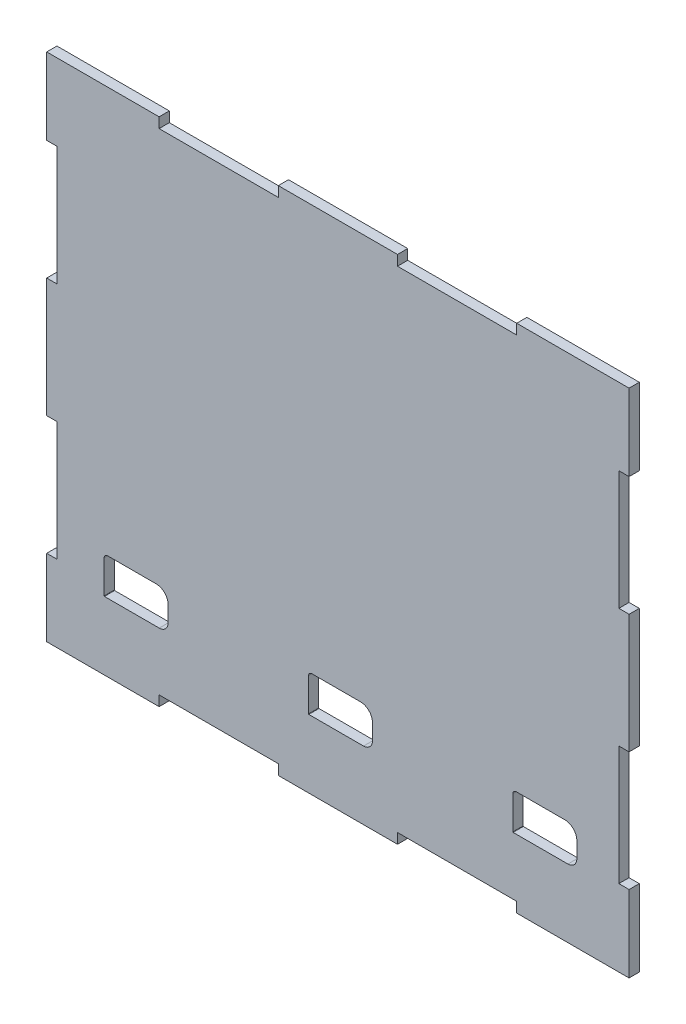
from build123d import *

# Parameters (mm, degrees)
BOSS_EXTRUDE1_DEPTH = 3
CUT_EXTRUDE1_DEPTH  = 114.772799913


with BuildPart() as part:
    # Model → Boss-Extrude1 (new body)
    with BuildSketch(Plane.XY):
        Polygon((85.5, 75), (82.5, 75), (52.5, 75), (52.5, 72), (17.5, 72), (17.5, 75), (-17.5, 75), (-17.5, 72), (-52.5, 72), (-52.5, 75), (-82.5, 75), (-85.5, 75), (-85.5, 72), (-85.5, 52.5), (-82.5, 52.5), (-82.5, 17.5), (-85.5, 17.5), (-85.5, -17.5), (-82.5, -17.5), (-82.5, -52.5), (-85.5, -52.5), (-85.5, -72), (-85.5, -75), (-82.5, -75), (-52.5, -75), (-52.5, -72), (-17.5, -72), (-17.5, -75), (17.5, -75), (17.5, -72), (52.5, -72), (52.5, -75), (82.5, -75), (85.5, -75), (85.5, -72), (85.5, -52.5), (82.5, -52.5), (82.5, -17.5), (85.5, -17.5), (85.5, 17.5), (82.5, 17.5), (82.5, 52.5), (85.5, 52.5), (85.5, 72), align=None)
    extrude(amount=BOSS_EXTRUDE1_DEPTH)

    # Sketch1 → Cut-Extrude1 (cut, through all)
    with BuildSketch(Plane.XY.offset(3)):
        with BuildLine():
            Line((-52.4625, -55), (-68.5375, -55))
            ThreePointArc((-68.5375, -55), (-68.608210678, -54.970710678), (-68.6375, -54.9))
            Line((-68.6375, -54.9), (-68.6375, -45.2))
            ThreePointArc((-68.6375, -45.2), (-68.344606781, -44.492893219), (-67.6375, -44.2))
            Line((-67.6375, -44.2), (-53.3625, -44.2))
            ThreePointArc((-53.3625, -44.2), (-50.869948596, -45.232448596), (-49.8375, -47.725))
            Line((-49.8375, -47.725), (-49.8375, -52.375))
            ThreePointArc((-49.8375, -52.375), (-50.606344699, -54.231155301), (-52.4625, -55))
        make_face()
        with BuildLine():
            Line((7.5375, -55), (-8.5375, -55))
            ThreePointArc((-8.5375, -55), (-8.608210678, -54.970710678), (-8.6375, -54.9))
            Line((-8.6375, -54.9), (-8.6375, -45.2))
            ThreePointArc((-8.6375, -45.2), (-8.344606781, -44.492893219), (-7.6375, -44.2))
            Line((-7.6375, -44.2), (6.6375, -44.2))
            ThreePointArc((6.6375, -44.2), (9.130051404, -45.232448596), (10.1625, -47.725))
            Line((10.1625, -47.725), (10.1625, -52.375))
            ThreePointArc((10.1625, -52.375), (9.393655301, -54.231155301), (7.5375, -55))
        make_face()
        with BuildLine():
            Line((67.5375, -55), (51.4625, -55))
            ThreePointArc((51.4625, -55), (51.391789322, -54.970710678), (51.3625, -54.9))
            Line((51.3625, -54.9), (51.3625, -45.2))
            ThreePointArc((51.3625, -45.2), (51.655393219, -44.492893219), (52.3625, -44.2))
            Line((52.3625, -44.2), (66.6375, -44.2))
            ThreePointArc((66.6375, -44.2), (69.130051404, -45.232448596), (70.1625, -47.725))
            Line((70.1625, -47.725), (70.1625, -52.375))
            ThreePointArc((70.1625, -52.375), (69.393655301, -54.231155301), (67.5375, -55))
        make_face()
    extrude(amount=-CUT_EXTRUDE1_DEPTH, mode=Mode.SUBTRACT)


solid = part.part
